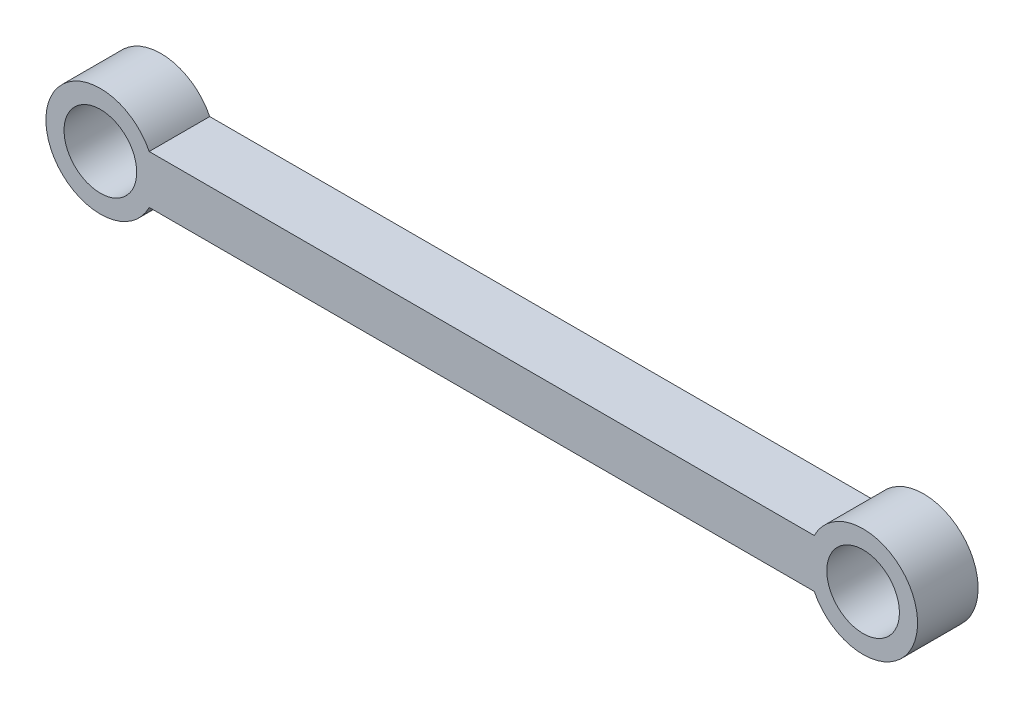
from build123d import *

# Parameters (mm, degrees)
SKETCH1_R           = 3.81
BOSS_EXTRUDE1_DEPTH = 6.35


with BuildPart() as part:
    # Sketch1 → Boss-Extrude1 (new body)
    with BuildSketch(Plane.XY):
        with BuildLine():
            Line((5.11953367, 2.54), (74.89046633, 2.54))
            ThreePointArc((74.89046633, 2.54), (85.725, 0), (74.89046633, -2.54))
            Line((74.89046633, -2.54), (5.11953367, -2.54))
            ThreePointArc((5.11953367, -2.54), (-5.715, 0), (5.11953367, 2.54))
        make_face()
        Circle(SKETCH1_R, mode=Mode.SUBTRACT)
        with Locations((80.01, 0)):
            Circle(SKETCH1_R, mode=Mode.SUBTRACT)
    extrude(amount=BOSS_EXTRUDE1_DEPTH)


solid = part.part
